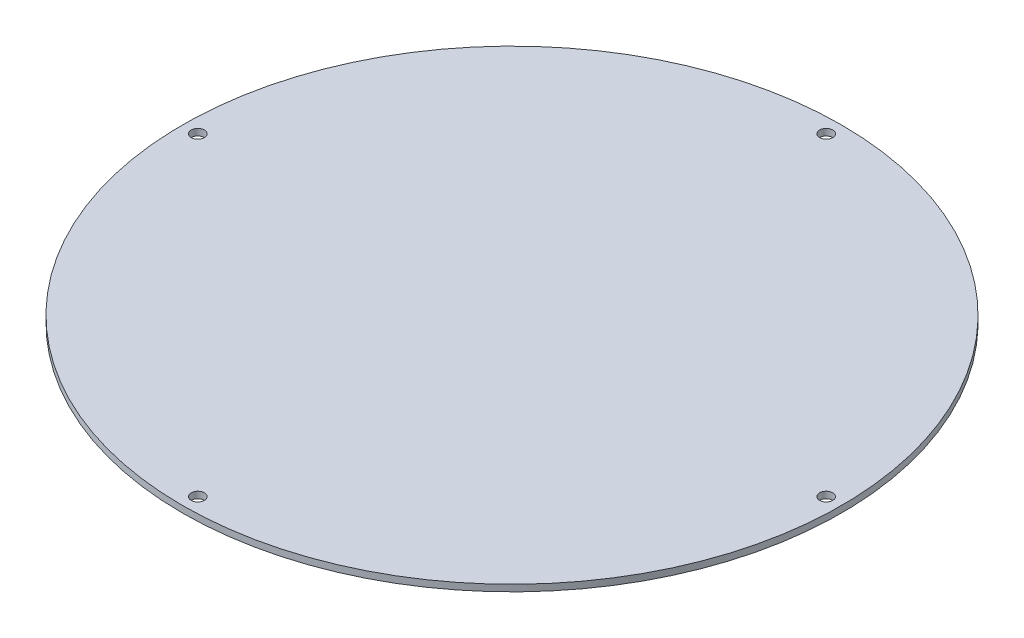
from build123d import *

# Parameters (mm, degrees)
SKETCH1_R           = 75
SKETCH1_R_2         = 1.5
BOSS_EXTRUDE2_DEPTH = 1.5


with BuildPart() as part:
    # Sketch1 → Boss-Extrude2 (new body)
    with BuildSketch(Plane(origin=(0, 0, 0), x_dir=(1, 0, 0), z_dir=(0, 1, 0))):
        with Locations(Location((0, 0, 0), (0, 0, 270))):
            Circle(SKETCH1_R)
        with Locations(Location((0, 71.5, 0), (0, 0, 270))):
            Circle(SKETCH1_R_2, mode=Mode.SUBTRACT)
        with Locations(Location((71.5, 0, 0), (0, 0, 270))):
            Circle(SKETCH1_R_2, mode=Mode.SUBTRACT)
        with Locations(Location((0, -71.5, 0), (0, 0, 270))):
            Circle(SKETCH1_R_2, mode=Mode.SUBTRACT)
        with Locations(Location((-71.5, 0, 0), (0, 0, 270))):
            Circle(SKETCH1_R_2, mode=Mode.SUBTRACT)
    extrude(amount=BOSS_EXTRUDE2_DEPTH)


solid = part.part
